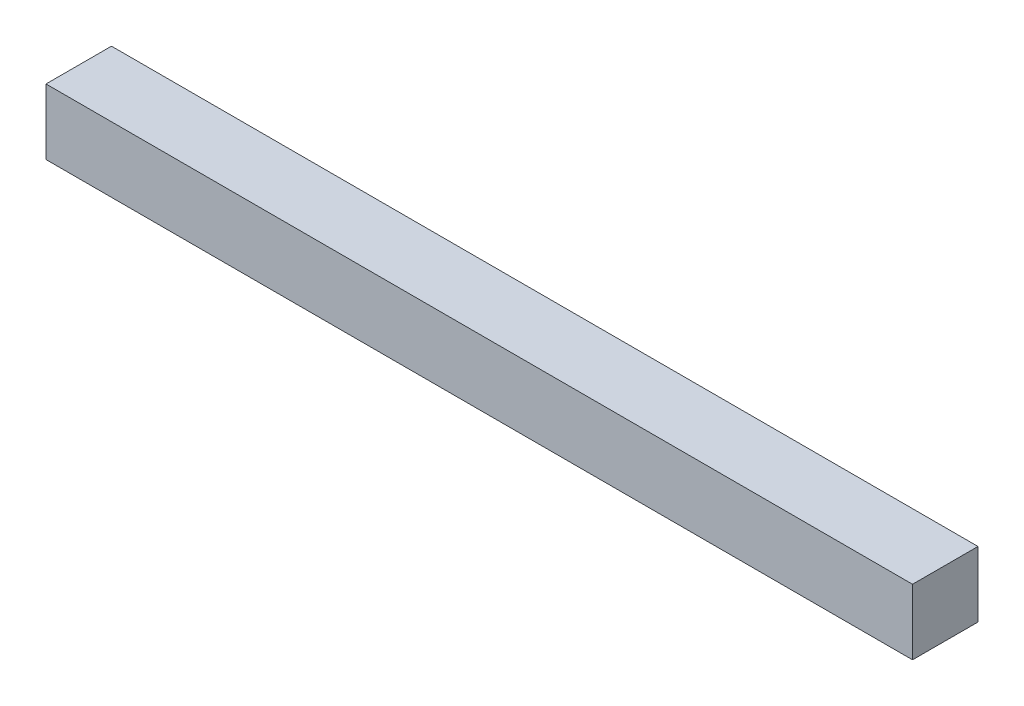
from build123d import *

# Parameters (mm, degrees)
SKETCH1_W           = 14.99997
SKETCH1_H           = 14.99997
BOSS_EXTRUDE1_DEPTH = 198.5199992


with BuildPart() as part:
    # Sketch1 → Boss-Extrude1 (new body)
    with BuildSketch(Plane(origin=(0, 0, 0), x_dir=(0, 0, -1), z_dir=(1, 0, 0))):
        with Locations((7.499985, 7.499985)):
            Rectangle(SKETCH1_W, SKETCH1_H)
    extrude(amount=BOSS_EXTRUDE1_DEPTH)


solid = part.part
